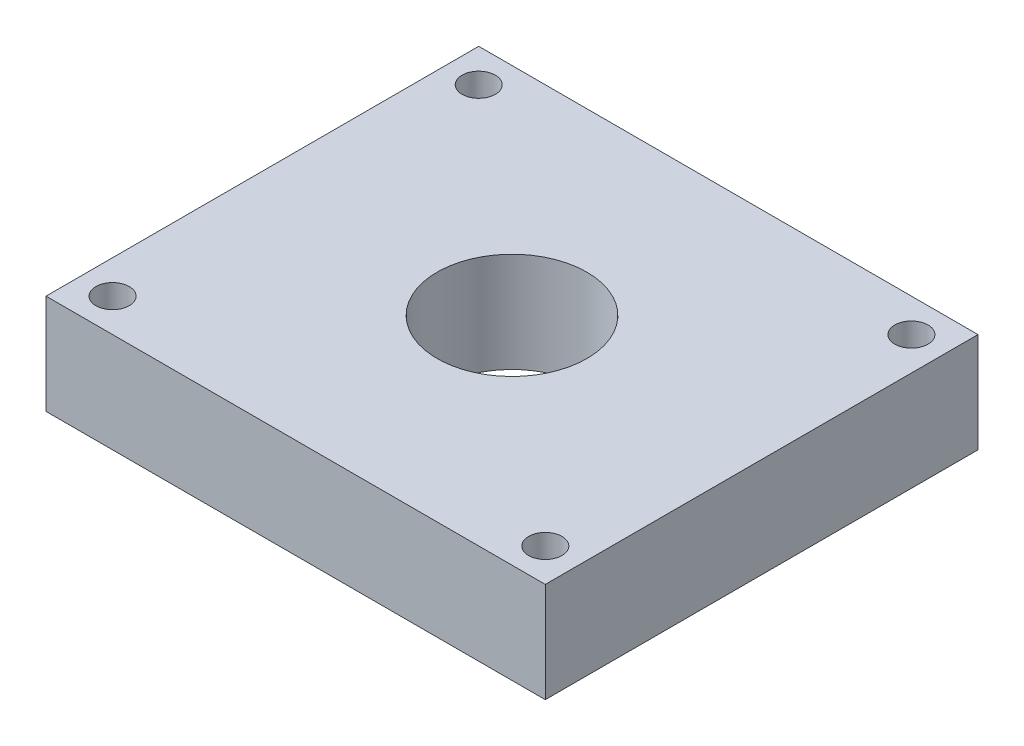
from build123d import *

# Parameters (mm, degrees)
SKETCH1_W           = 95.25
SKETCH1_H           = 82.55
SKETCH1_R           = 14.2875
SKETCH1_R_2         = 3.175
BOSS_EXTRUDE1_DEPTH = 19.05


with BuildPart() as part:
    # Sketch1 → Boss-Extrude1 (new body)
    with BuildSketch(Plane(origin=(0, 0, 0), x_dir=(1, 0, 0), z_dir=(0, 1, 0))):
        Rectangle(SKETCH1_W, SKETCH1_H)
        with Locations(Location((0, 0, 0), (0, 0, 90))):
            Circle(SKETCH1_R, mode=Mode.SUBTRACT)
        with Locations(Location((-41.275, 34.925, 0), (0, 0, 90))):
            Circle(SKETCH1_R_2, mode=Mode.SUBTRACT)
        with Locations(Location((-41.275, -34.925, 0), (0, 0, 90))):
            Circle(SKETCH1_R_2, mode=Mode.SUBTRACT)
        with Locations(Location((41.275, 34.925, 0), (0, 0, 90))):
            Circle(SKETCH1_R_2, mode=Mode.SUBTRACT)
        with Locations(Location((41.275, -34.925, 0), (0, 0, 90))):
            Circle(SKETCH1_R_2, mode=Mode.SUBTRACT)
    extrude(amount=BOSS_EXTRUDE1_DEPTH)


solid = part.part
